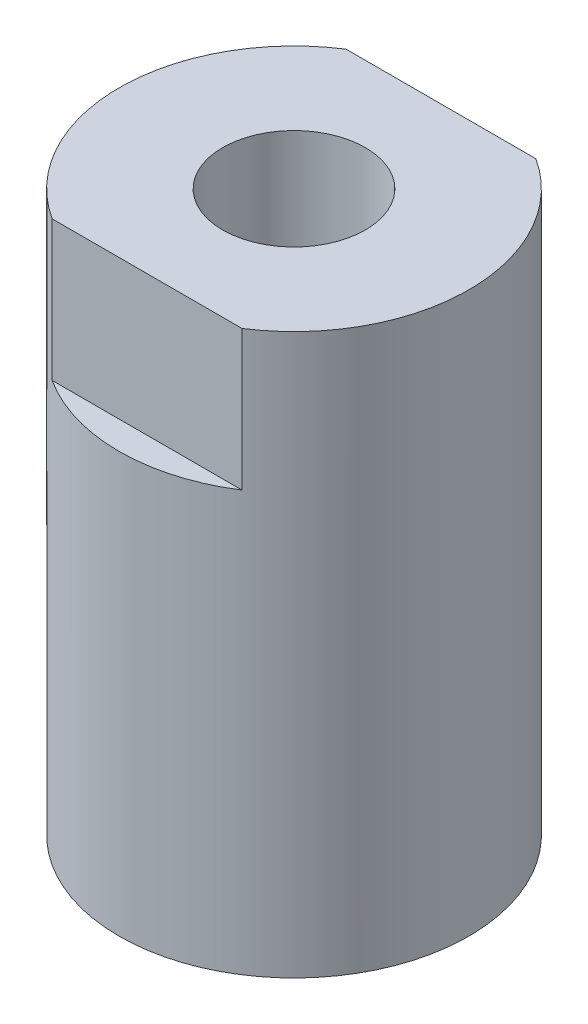
from build123d import *

# Parameters (mm, degrees)
SKETCH_1_R          = 12.5
EXTRUDE_1_DEPTH     = 40
SKETCH_2_W          = 36
SKETCH_2_H          = 27
SKETCH_2_W_2        = 30
SKETCH_2_H_2        = 21
CUT_EXTRUDE_1_DEPTH = 10
HOLE_WIZARD_M12_1_D = 10.2


with BuildPart() as part:
    # 草图1 → 凸台-拉伸1 (new body)
    with BuildSketch(Plane(origin=(0, 0, 0), x_dir=(1, 0, 0), z_dir=(0, 1, 0))):
        with Locations(Location((0, 0, 0), (0, 0, 270))):
            Circle(SKETCH_1_R)
    extrude(amount=EXTRUDE_1_DEPTH)

    # 草图2 → 切除-拉伸1 (cut)
    with BuildSketch(Plane(origin=(0, 40, 0), x_dir=(1, 0, 0), z_dir=(0, 1, 0))):
        Rectangle(SKETCH_2_W, SKETCH_2_H)
        Rectangle(SKETCH_2_W_2, SKETCH_2_H_2, mode=Mode.SUBTRACT)
    extrude(amount=-CUT_EXTRUDE_1_DEPTH, mode=Mode.SUBTRACT)

    # M12 螺纹孔1 (through all)
    with Locations(Plane(origin=(0, 40, 0), x_dir=(1, 0, 0), z_dir=(0, 1, 0))):
        with Locations((0, 0)):
            Hole(HOLE_WIZARD_M12_1_D / 2)


solid = part.part
